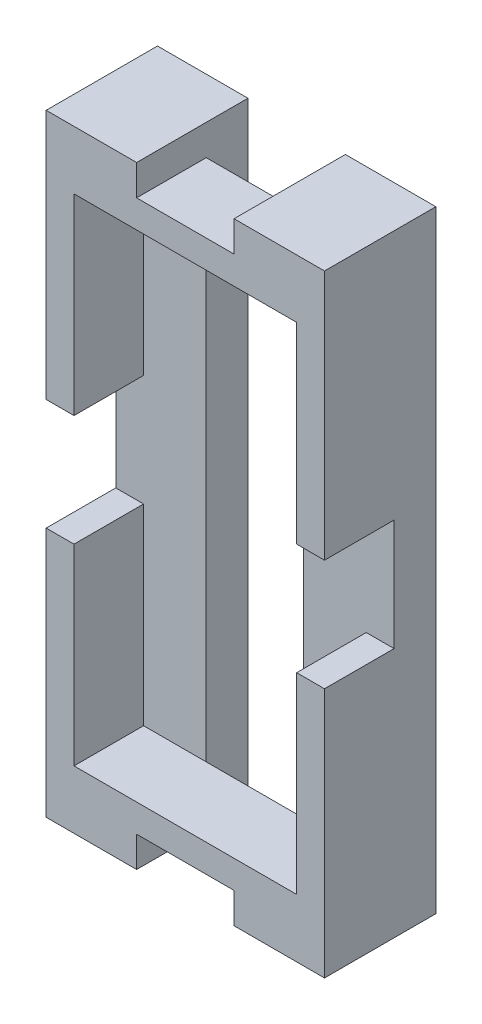
from build123d import *

# Parameters (mm, degrees)
SKETCH1_W           = 10
SKETCH1_H           = 22
BOSS_EXTRUDE1_DEPTH = 4
SKETCH2_W           = 3.5
SKETCH2_H           = 22
SLOT_DEPTH          = 1.5
SKETCH3_W           = 3.5
SKETCH3_H           = 1.1
CUT_EXTRUDE2_DEPTH  = 2.5
SKETCH4_W           = 8
SKETCH4_H           = 17.8
CUT_EXTRUDE3_DEPTH  = 2.5
CUT_EXTRUDE4_REACH  = 17.395
SKETCH6_W           = 2.5
SKETCH6_H           = 4


with BuildPart() as part:
    # Sketch1 → Boss-Extrude1 (new body)
    with BuildSketch(Plane.XY):
        Rectangle(SKETCH1_W, SKETCH1_H)
    extrude(amount=BOSS_EXTRUDE1_DEPTH)

    # Sketch2 → slot (cut)
    with BuildSketch(Plane(origin=(0, 0, 0), x_dir=(-1, 0, 0), z_dir=(0, 0, -1))):
        Rectangle(SKETCH2_W, SKETCH2_H)
    extrude(amount=-SLOT_DEPTH, mode=Mode.SUBTRACT)

    # Sketch3 → Cut-Extrude2 (cut)
    with BuildSketch(Plane(origin=(0, 0, 1.5), x_dir=(-1, 0, 0), z_dir=(0, 0, -1))):
        with Locations((0, 10.45)):
            Rectangle(SKETCH3_W, SKETCH3_H)
        with Locations((0, -10.45)):
            Rectangle(SKETCH3_W, SKETCH3_H)
    extrude(amount=-CUT_EXTRUDE2_DEPTH, mode=Mode.SUBTRACT)

    # Sketch4 → Cut-Extrude3 (cut)
    with BuildSketch(Plane.XY.offset(4)):
        Rectangle(SKETCH4_W, SKETCH4_H)
    extrude(amount=-CUT_EXTRUDE3_DEPTH, mode=Mode.SUBTRACT)

    # Cut-Extrude4: up to this face of the body (flat: up to its plane)
    cut_extrude4_end = Plane(part.part.faces().sort_by_distance((5, 0, 2))[0])
    # Sketch6 → Cut-Extrude4 (cut, up to the picked face)
    with BuildSketch(Plane.ZY.offset(5), mode=Mode.PRIVATE) as cut_extrude4_sk1:
        with Locations((2.75, 0)):
            Rectangle(SKETCH6_W, SKETCH6_H)
    cut_extrude4_tool1 = split(extrude(cut_extrude4_sk1.sketch, amount=-CUT_EXTRUDE4_REACH, mode=Mode.PRIVATE), bisect_by=cut_extrude4_end, keep=Keep.BOTH, mode=Mode.PRIVATE)
    add(cut_extrude4_tool1.solids().sort_by(Axis((-5, 0, 2.75), (1, 0, 0)))[0], mode=Mode.SUBTRACT)


solid = part.part
